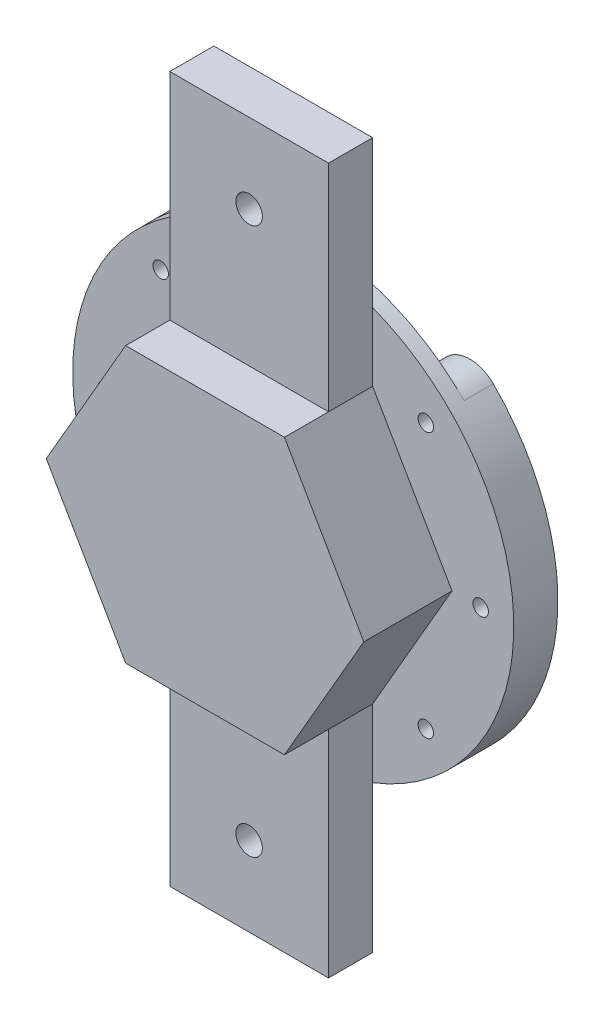
from build123d import *

# Parameters (mm, degrees)
SKETCH_1_R          = 1.75
EXTRUDE_1_DEPTH     = 6.6
EXTRUDE_1_2_DEPTH   = 6.6
SKETCH_2_R          = 50
EXTRUDE_2_DEPTH     = 3.4
SKETCH_4_R          = 1.75
CUT_EXTRUDE_2_DEPTH = 10
EXTRUDE_7_DEPTH     = 20
SKETCH_10_W         = 36
SKETCH_10_H         = 48.823085464
CUT_EXTRUDE_3_DEPTH = 10
SKETCH_11_R         = 3
CUT_EXTRUDE_6_DEPTH = 10


with BuildPart() as part:
    # 草图1 → 凸台-拉伸1 (new body)
    with BuildSketch(Plane.XY):
        with BuildLine():
            ThreePointArc((20.506096654, 20.506096654), (29, 0), (20.506096654, -20.506096654))
            Line((20.506096654, -20.506096654), (24.748737342, -24.748737342))
            ThreePointArc((24.748737342, -24.748737342), (24.748737342, -35.355339059), (35.355339059, -35.355339059))
            ThreePointArc((35.355339059, -35.355339059), (50, 0), (35.355339059, 35.355339059))
            ThreePointArc((35.355339059, 35.355339059), (24.748737342, 35.355339059), (24.748737342, 24.748737342))
            Line((24.748737342, 24.748737342), (20.506096654, 20.506096654))
        make_face()
        with Locations((30.0520382, 30.0520382)):
            Circle(SKETCH_1_R, mode=Mode.SUBTRACT)
        with Locations((30.0520382, -30.0520382)):
            Circle(SKETCH_1_R, mode=Mode.SUBTRACT)
        with Locations((42.5, 0)):
            Circle(SKETCH_1_R, mode=Mode.SUBTRACT)
    extrude(amount=EXTRUDE_1_DEPTH)



with BuildPart() as body_2:
    # 草图1 → Extrude 1 2 (new body)
    with BuildSketch(Plane.XY):
        with BuildLine():
            ThreePointArc((-35.355339059, 35.355339059), (-50, 0), (-35.355339059, -35.355339059))
            ThreePointArc((-35.355339059, -35.355339059), (-24.748737342, -35.355339059), (-24.748737342, -24.748737342))
            Line((-24.748737342, -24.748737342), (-20.506096654, -20.506096654))
            ThreePointArc((-20.506096654, -20.506096654), (-29, 0), (-20.506096654, 20.506096654))
            Line((-20.506096654, 20.506096654), (-24.748737342, 24.748737342))
            ThreePointArc((-24.748737342, 24.748737342), (-24.748737342, 35.355339059), (-35.355339059, 35.355339059))
        make_face()
        with Locations((-30.0520382, 30.0520382)):
            Circle(SKETCH_1_R, mode=Mode.SUBTRACT)
        with Locations((-30.0520382, -30.0520382)):
            Circle(SKETCH_1_R, mode=Mode.SUBTRACT)
        with Locations((-42.5, 0)):
            Circle(SKETCH_1_R, mode=Mode.SUBTRACT)
    extrude(amount=EXTRUDE_1_2_DEPTH)


with BuildPart() as part_1:
    add(part.part)

    add(body_2.part)  # 凸台-拉伸2 merges body 2
    # 草图2 → 凸台-拉伸2 (add)
    with BuildSketch(Plane.XY.offset(6.6)):
        with Locations(Location((0, 0, 0), (0, 0, 225))):
            Circle(SKETCH_2_R)
    extrude(amount=EXTRUDE_2_DEPTH)

    # 草图4 → 切除-拉伸2 (cut, symmetric)
    with BuildSketch(Plane(origin=(0, 0, 6.6), x_dir=(-1, 0, 0), z_dir=(0, 0, -1))):
        with Locations(Location((-42.5, 0, 0), (0, 0, 180))):
            Circle(SKETCH_4_R)
        with Locations(Location((-30.0520382, 30.0520382, 0), (0, 0, 180))):
            Circle(SKETCH_4_R)
        with Locations(Location((-30.0520382, -30.0520382, 0), (0, 0, 180))):
            Circle(SKETCH_4_R)
        with Locations(Location((30.0520382, -30.0520382, 0), (0, 0, 180))):
            Circle(SKETCH_4_R)
        with Locations(Location((42.5, 0, 0), (0, 0, 180))):
            Circle(SKETCH_4_R)
        with Locations(Location((30.0520382, 30.0520382, 0), (0, 0, 180))):
            Circle(SKETCH_4_R)
    extrude(amount=CUT_EXTRUDE_2_DEPTH, both=True, mode=Mode.SUBTRACT)

    # 草图5 → 凸台-拉伸7 (add)
    with BuildSketch(Plane.XY.offset(10)):
        Polygon((-18, -31.176914536), (-18, -80), (18, -80), (18, -31.176914536), (36, 0), (18, 31.176914536), (18, 80), (-18, 80), (-18, 31.176914536), (-36, 0), align=None)
    extrude(amount=EXTRUDE_7_DEPTH)

    # 草图10 → 切除-拉伸3 (cut)
    with BuildSketch(Plane.XY.offset(30)):
        with Locations((0, -55.588457268)):
            Rectangle(SKETCH_10_W, SKETCH_10_H)
        with Locations((0, 55.588457268)):
            Rectangle(SKETCH_10_W, SKETCH_10_H)
    extrude(amount=-CUT_EXTRUDE_3_DEPTH, mode=Mode.SUBTRACT)

    # 草图11 → 切除-拉伸6 (cut)
    with BuildSketch(Plane.XY.offset(20)):
        with Locations((0, 62)):
            Circle(SKETCH_11_R)
    cut_extrude_6 = extrude(amount=-CUT_EXTRUDE_6_DEPTH, mode=Mode.SUBTRACT)

    # 镜向2: 切除-拉伸6 across plane
    add(cut_extrude_6.mirror(Plane.ZX), mode=Mode.SUBTRACT)


solid = part_1.part
